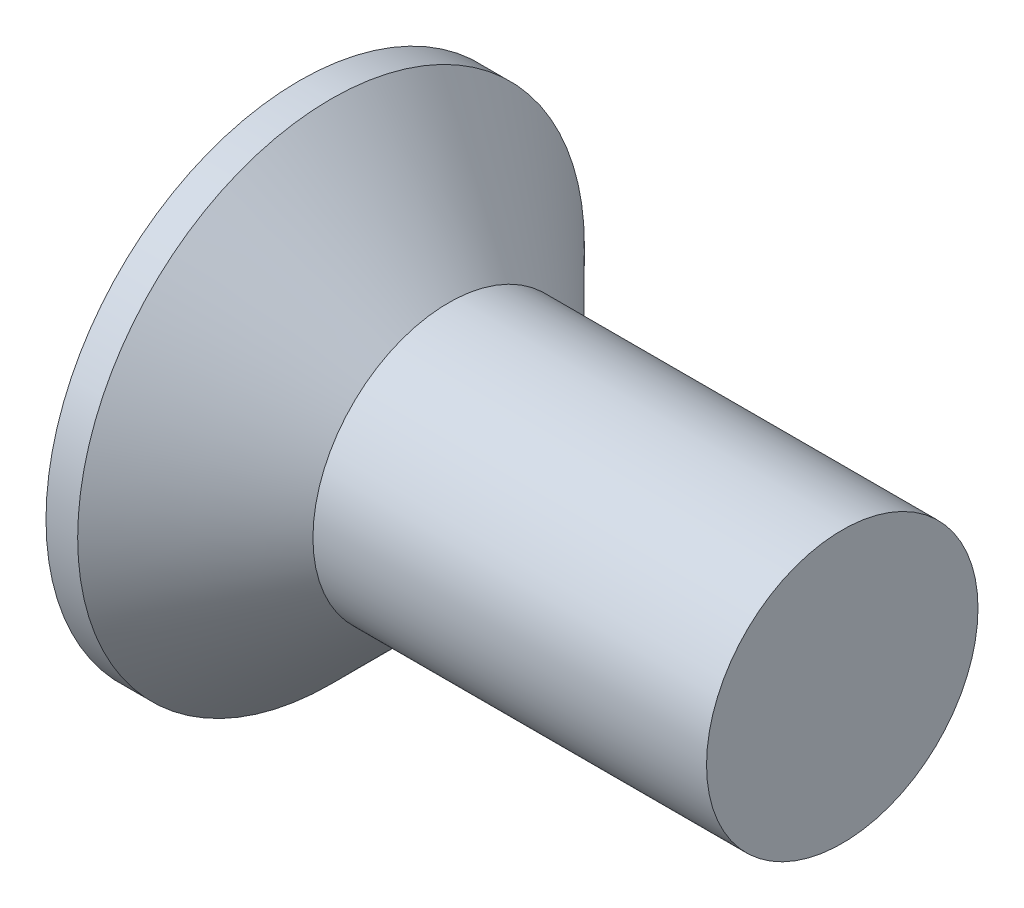
from build123d import *

# Parameters (mm, degrees)
RECPAT_COUNT = 2
RECPAT_ANGLE = 90


with BuildPart() as part:
    # BodySke → Base-Revolve (revolve)
    with BuildSketch(Plane.XY, mode=Mode.PRIVATE) as base_revolve_sk:
        Polygon((0, 0), (0, 2.8), (0.35, 2.8), (1.65, 1.5), (6, 1.5), (6, 0), align=None)
    revolve(base_revolve_sk.sketch.rotate(Axis((-6.35, 0, 0), (1, 0, 0)), 90), axis=Axis((-6.35, 0, 0), (1, 0, 0)))

    # Sketch3 → Recess section 0
    with BuildSketch(Plane.ZY):
        with BuildLine():
            Line((-0.265, 1.4), (0.265, 1.4))
            Line((0.265, 1.4), (0.265, -1.4))
            Line((0.265, -1.4), (-0.265, -1.4))
            Line((-0.265, -1.4), (-0.265, 1.4))
        make_face()
    # Sketch4 → Recess section 1
    with BuildSketch(Plane.ZY.offset(-1.5)):
        with BuildLine():
            Line((-0.265, 0.652127713), (0.265, 0.652127713))
            Line((0.265, 0.652127713), (0.265, -0.652127713))
            Line((0.265, -0.652127713), (-0.265, -0.652127713))
            Line((-0.265, -0.652127713), (-0.265, 0.652127713))
        make_face()
    recess = loft(mode=Mode.SUBTRACT)

    # RecPat: Recess ×2 about axis
    recpat_axis = Axis((0, 0, 0), (1, 0, 0))
    for i in range(1, RECPAT_COUNT):
        add(recess.rotate(recpat_axis, i * RECPAT_ANGLE / (RECPAT_COUNT - 1)), mode=Mode.SUBTRACT)

    # RecCorSke → RecessCore (revolve, cut)
    with BuildSketch(Plane.XY, mode=Mode.PRIVATE) as recesscore_sk:
        Polygon((0, 0), (0, 0.660890218), (1.5, 0.556), (1.680655351, 0), align=None)
    revolve(recesscore_sk.sketch.rotate(Axis((-3.175, 0, 0), (1, 0, 0)), 90), axis=Axis((-3.175, 0, 0), (1, 0, 0)), mode=Mode.SUBTRACT)


solid = part.part
